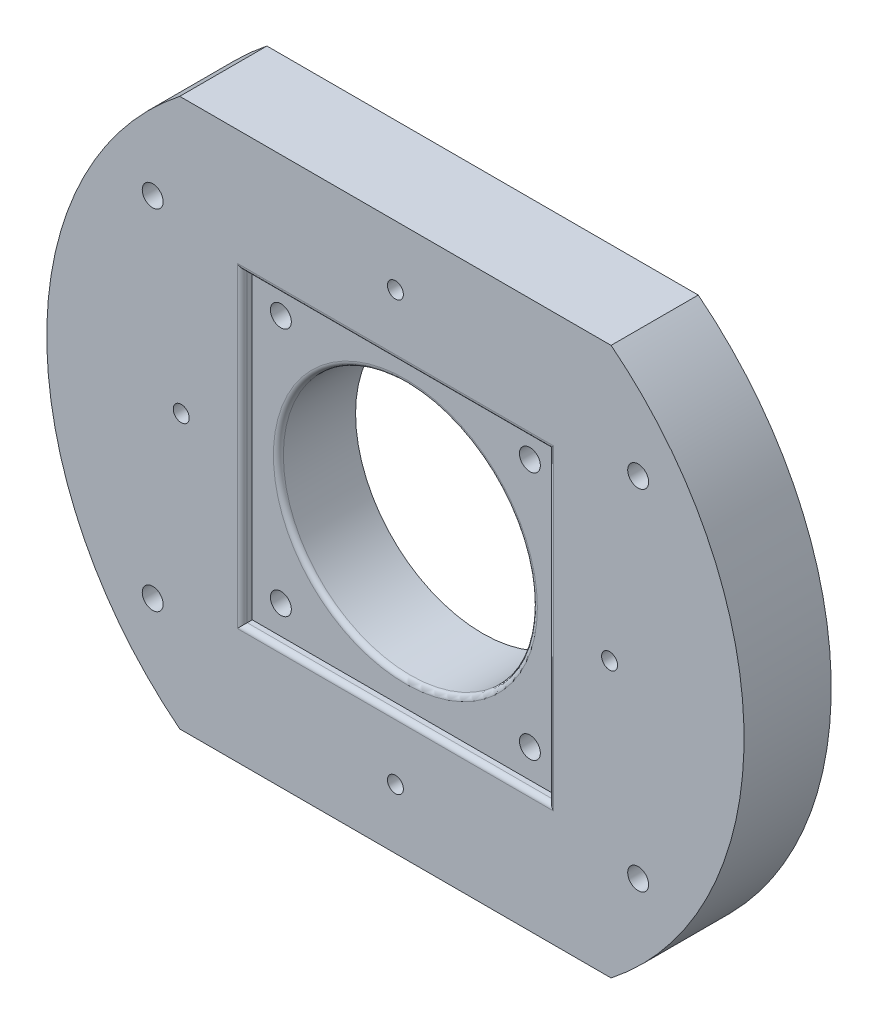
from build123d import *

# Parameters (mm, degrees)
SKETCH1_R           = 70
SKETCH1_R_2         = 25.5
SKETCH1_R_3         = 2.1
BOSS_EXTRUDE1_DEPTH = 17.5
SKETCH2_W           = 61.5
SKETCH2_H           = 61.5
CUT_EXTRUDE1_DEPTH  = 2
SKETCH3_R           = 1.6
CUT_EXTRUDE2_DEPTH  = 101.529846314
SKETCH4_R           = 3.5
CUT_EXTRUDE3_DEPTH  = 6.2
SKETCH5_R           = 2.1
CUT_EXTRUDE4_DEPTH  = 17.5
FILLET1_R           = 1


with BuildPart() as part:
    # Sketch1 → Boss-Extrude1 (new body)
    with BuildSketch(Plane.XY):
        Circle(SKETCH1_R)
        Circle(SKETCH1_R_2, mode=Mode.SUBTRACT)
        with Locations((-25, 25)):
            Circle(SKETCH1_R_3, mode=Mode.SUBTRACT)
        with Locations((25, 25)):
            Circle(SKETCH1_R_3, mode=Mode.SUBTRACT)
        with Locations((25, -25)):
            Circle(SKETCH1_R_3, mode=Mode.SUBTRACT)
        with Locations((-25, -25)):
            Circle(SKETCH1_R_3, mode=Mode.SUBTRACT)
    extrude(amount=BOSS_EXTRUDE1_DEPTH)

    # Sketch2 → Cut-Extrude1 (cut)
    with BuildSketch(Plane.XY.offset(17.5)):
        Rectangle(SKETCH2_W, SKETCH2_H)
    extrude(amount=-CUT_EXTRUDE1_DEPTH, mode=Mode.SUBTRACT)

    # Sketch3 → Cut-Extrude2 (cut, through all)
    with BuildSketch(Plane.XY.offset(17.5)):
        with Locations((0, 43)):
            Circle(SKETCH3_R)
        with Locations((-43, 0)):
            Circle(SKETCH3_R)
        with Locations((43, 0)):
            Circle(SKETCH3_R)
        with Locations((0, -43)):
            Circle(SKETCH3_R)
    extrude(amount=-CUT_EXTRUDE2_DEPTH, mode=Mode.SUBTRACT)

    # Sketch4 → Cut-Extrude3 (cut)
    with BuildSketch(Plane(origin=(0, 0, 0), x_dir=(-1, 0, 0), z_dir=(0, 0, -1))):
        with Locations((-25, 25)):
            Circle(SKETCH4_R)
        with Locations((25, 25)):
            Circle(SKETCH4_R)
        with Locations((25, -25)):
            Circle(SKETCH4_R)
        with Locations((-25, -25)):
            Circle(SKETCH4_R)
    extrude(amount=-CUT_EXTRUDE3_DEPTH, mode=Mode.SUBTRACT)

    # Sketch5 → Cut-Extrude4 (cut)
    with BuildSketch(Plane(origin=(0, 0, 0), x_dir=(-1, 0, 0), z_dir=(0, 0, -1))):
        with Locations((-48.733971724, 35)):
            Circle(SKETCH5_R)
        with Locations((48.733971724, 35)):
            Circle(SKETCH5_R)
        with Locations((48.733971724, -35)):
            Circle(SKETCH5_R)
        with Locations((-48.733971724, -35)):
            Circle(SKETCH5_R)
        with BuildLine():
            Line((-43.301270189, -55), (43.301270189, -55))
            ThreePointArc((43.301270189, -55), (0, -70), (-43.301270189, -55))
        make_face()
        with BuildLine():
            Line((-43.301270189, 55), (43.301270189, 55))
            ThreePointArc((43.301270189, 55), (0, 70), (-43.301270189, 55))
        make_face()
    extrude(amount=-CUT_EXTRUDE4_DEPTH, mode=Mode.SUBTRACT)

    # Fillet1
    fillet1_edges = [part.edges().sort_by_distance(p)[0] for p in [
        (-25.5, 0, 15.5),
        (30.75, 0, 17.5),
        (0, 30.75, 17.5),
        (-30.75, 0, 17.5),
        (0, -30.75, 17.5),
        (28.5, 25, 0),
        (-21.5, 25, 0),
        (-21.5, -25, 0),
        (28.5, -25, 0),
    ]]
    fillet(fillet1_edges, radius=FILLET1_R)


solid = part.part
